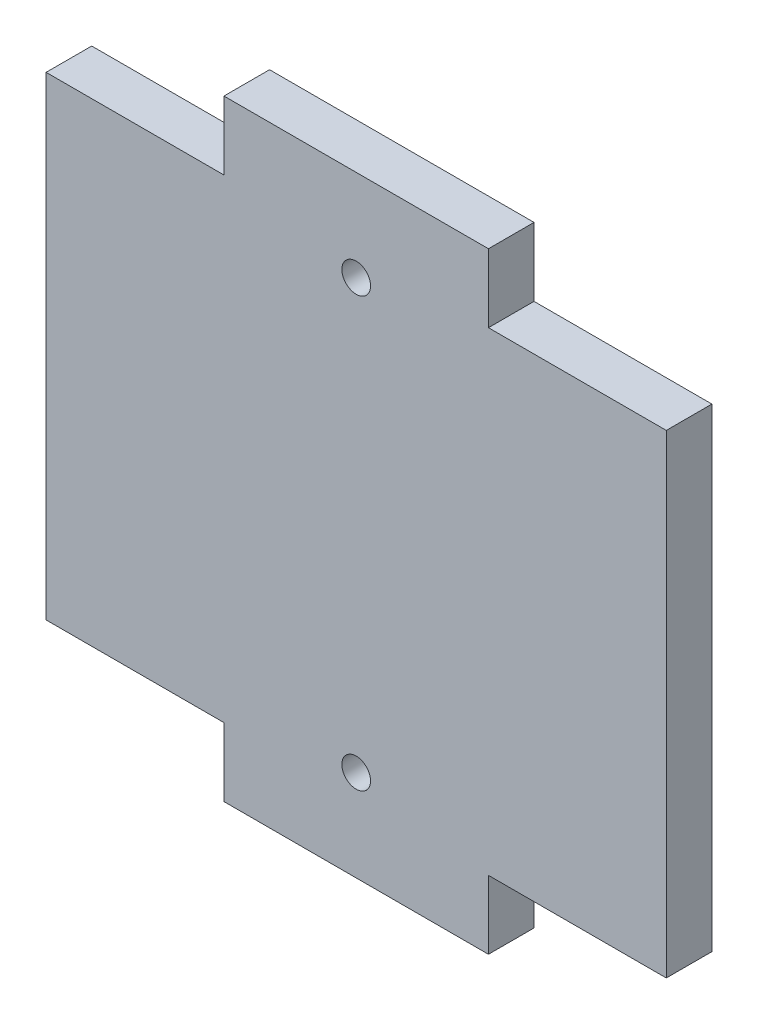
from build123d import *

# Parameters (mm, degrees)
SKETCH1_R           = 0.5
BOSS_EXTRUDE1_DEPTH = 1.5875
SKETCH1_3_W         = 15.24
SKETCH1_3_H         = 10.16
BOSS_EXTRUDE2_DEPTH = 3.175


with BuildPart() as part:
    # Sketch1 → Boss-Extrude1 (new body)
    with BuildSketch(Plane.XY):
        Polygon((4.60375, -8.255), (10.795, -8.255), (10.795, 8.255), (4.60375, 8.255), (4.60375, 10.63625), (-4.60375, 10.63625), (-4.60375, 8.255), (-10.795, 8.255), (-10.795, -8.255), (-4.60375, -8.255), (-4.60375, -10.63625), (4.60375, -10.63625), align=None)
        with Locations((0, -7.46125)):
            Circle(SKETCH1_R, mode=Mode.SUBTRACT)
        with Locations((0, 7.46125)):
            Circle(SKETCH1_R, mode=Mode.SUBTRACT)
    extrude(amount=BOSS_EXTRUDE1_DEPTH)

    # Sketch1<3> → Boss-Extrude2 (add)
    with BuildSketch(Plane.XY):
        Rectangle(SKETCH1_3_W, SKETCH1_3_H)
    extrude(amount=-BOSS_EXTRUDE2_DEPTH)


solid = part.part
